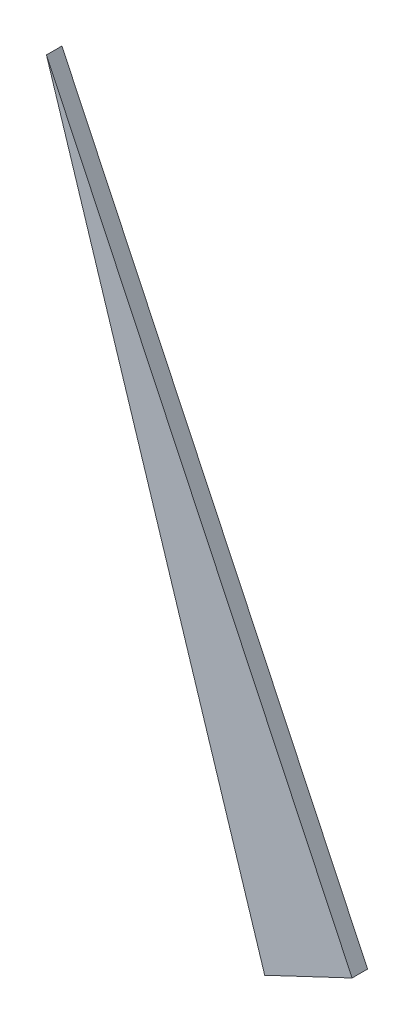
from build123d import *

# Parameters (mm, degrees)
BOSS_EXTRUDE1_DEPTH = 5.08


with BuildPart() as part:
    # Sketch1 → Boss-Extrude1 (new body)
    with BuildSketch(Plane.XY):
        Polygon((38.903421403, -80.241820695), (67.607633554, -66.672343741), (-32.806495904, 145.738826175), align=None)
    extrude(amount=BOSS_EXTRUDE1_DEPTH)


solid = part.part
